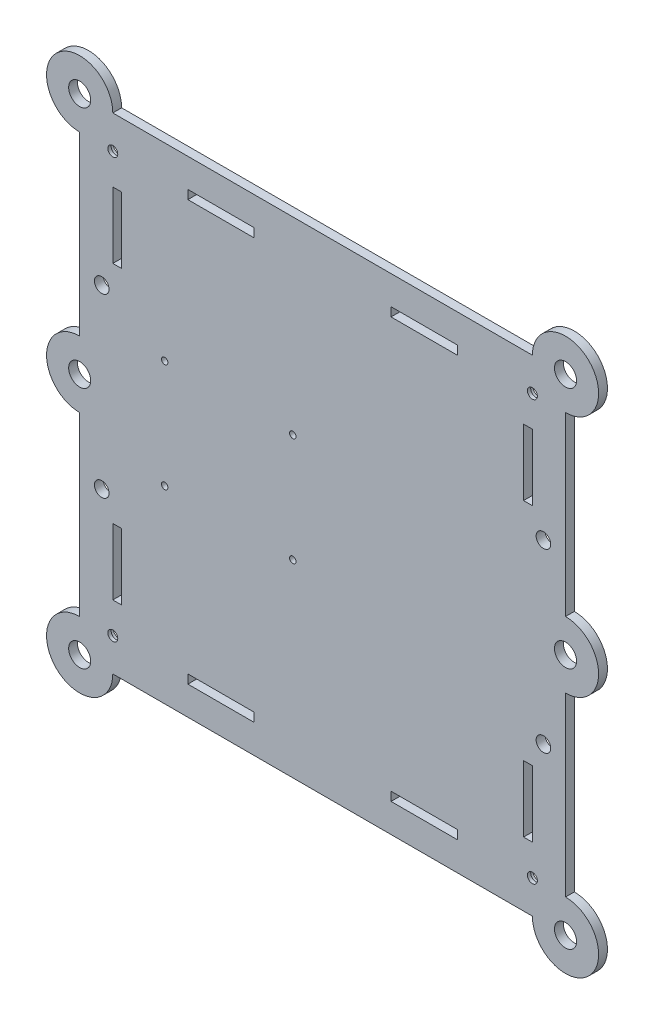
from build123d import *

# Parameters (mm, degrees)
FONDO_START                   = -54
SK_FONDO_R                    = 5
FONDO_DEPTH                   = 4
PASANTES_M4_SEPARADORES_START = -54
SK_PASANTES_M4_SEPARADORES_R  = 2.25
PASANTES_M4_SEPARADORES_DEPTH = 4
AVELLANADO_M4_START           = -54
SK_AVELLANADO_M4_R            = 4.2
AVELLANADO_M4_DEPTH           = 2.5
PASANTES_M2_5_RPI_START       = -54
SK_PASANTES_M2_5_RPI_R        = 1.45
PASANTES_M2_5_RPI_DEPTH       = 4
AVELLANADO_M2_5_START         = -54
SK_AVELLANADO_M2_5_R          = 2.5
AVELLANADO_M2_5_DEPTH         = 1.5
AGUJEROS_ANCLAJE_START        = -54
SK_AGUJEROS_ANCLAJE_R         = 3.3
AGUJEROS_ANCLAJE_DEPTH        = 4
CROQUIS3_W                    = 30
CROQUIS3_H                    = 4
CROQUIS3_W_2                  = 4
CROQUIS3_H_2                  = 30
CORTAR_EXTRUIR1_DEPTH         = 177.821944339


with BuildPart() as part:
    # Sk_Fondo → Fondo (new body)
    with BuildSketch(Plane.XY.offset(FONDO_START)):
        with BuildLine():
            Line((-110, 15), (-110, 95))
            ThreePointArc((-110, 95), (-120.606601718, 120.606601718), (-95, 110))
            Line((-95, 110), (95, 110))
            ThreePointArc((95, 110), (120.606601718, 120.606601718), (110, 95))
            Line((110, 95), (110, 15))
            ThreePointArc((110, 15), (125, 0), (110, -15))
            Line((110, -15), (110, -95))
            ThreePointArc((110, -95), (120.606601718, -120.606601718), (95, -110))
            Line((95, -110), (-95, -110))
            ThreePointArc((-95, -110), (-120.606601718, -120.606601718), (-110, -95))
            Line((-110, -95), (-110, -15))
            ThreePointArc((-110, -15), (-125, 0), (-110, 15))
        make_face()
        with Locations((-110, 110)):
            Circle(SK_FONDO_R, mode=Mode.SUBTRACT)
        with Locations((110, 110)):
            Circle(SK_FONDO_R, mode=Mode.SUBTRACT)
        with Locations((110, 0)):
            Circle(SK_FONDO_R, mode=Mode.SUBTRACT)
        with Locations((110, -110)):
            Circle(SK_FONDO_R, mode=Mode.SUBTRACT)
        with Locations((-110, -110)):
            Circle(SK_FONDO_R, mode=Mode.SUBTRACT)
        with Locations((-110, 0)):
            Circle(SK_FONDO_R, mode=Mode.SUBTRACT)
    extrude(amount=FONDO_DEPTH)

    # Sk_Pasantes_M4_separadores → Pasantes_M4_separadores (cut)
    with BuildSketch(Plane.XY.offset(PASANTES_M4_SEPARADORES_START)):
        with Locations((-95, -95)):
            Circle(SK_PASANTES_M4_SEPARADORES_R)
        with Locations((-95, 95)):
            Circle(SK_PASANTES_M4_SEPARADORES_R)
        with Locations((95, -95)):
            Circle(SK_PASANTES_M4_SEPARADORES_R)
        with Locations((95, 95)):
            Circle(SK_PASANTES_M4_SEPARADORES_R)
    extrude(amount=PASANTES_M4_SEPARADORES_DEPTH, mode=Mode.SUBTRACT)

    # Sk_Avellanado_M4 → Avellanado_M4 (cut)
    with BuildSketch(Plane.XY.offset(AVELLANADO_M4_START)):
        with Locations((-95, -95)):
            Circle(SK_AVELLANADO_M4_R)
        with Locations((-95, 95)):
            Circle(SK_AVELLANADO_M4_R)
        with Locations((95, -95)):
            Circle(SK_AVELLANADO_M4_R)
        with Locations((95, 95)):
            Circle(SK_AVELLANADO_M4_R)
    extrude(amount=AVELLANADO_M4_DEPTH, mode=Mode.SUBTRACT)

    # Sk_Pasantes_M2-5_RPi → Pasantes_M2-5_RPi (cut)
    with BuildSketch(Plane.XY.offset(PASANTES_M2_5_RPI_START)):
        with Locations((-13.5, -24.5)):
            Circle(SK_PASANTES_M2_5_RPI_R)
        with Locations((-13.5, 24.5)):
            Circle(SK_PASANTES_M2_5_RPI_R)
        with Locations((-71.5, -24.5)):
            Circle(SK_PASANTES_M2_5_RPI_R)
        with Locations((-71.5, 24.5)):
            Circle(SK_PASANTES_M2_5_RPI_R)
    extrude(amount=PASANTES_M2_5_RPI_DEPTH, mode=Mode.SUBTRACT)

    # Sk_Avellanado_M2-5 → Avellanado_M2-5 (cut)
    with BuildSketch(Plane.XY.offset(AVELLANADO_M2_5_START)):
        with Locations((-13.5, -24.5)):
            Circle(SK_AVELLANADO_M2_5_R)
        with Locations((-13.5, 24.5)):
            Circle(SK_AVELLANADO_M2_5_R)
        with Locations((-71.5, -24.5)):
            Circle(SK_AVELLANADO_M2_5_R)
        with Locations((-71.5, 24.5)):
            Circle(SK_AVELLANADO_M2_5_R)
    extrude(amount=AVELLANADO_M2_5_DEPTH, mode=Mode.SUBTRACT)

    # Sk_Agujeros_anclaje → Agujeros_anclaje (cut)
    with BuildSketch(Plane.XY.offset(AGUJEROS_ANCLAJE_START)):
        with Locations((-100, -40)):
            Circle(SK_AGUJEROS_ANCLAJE_R)
        with Locations((-100, 40)):
            Circle(SK_AGUJEROS_ANCLAJE_R)
        with Locations((100, -40)):
            Circle(SK_AGUJEROS_ANCLAJE_R)
        with Locations((100, 40)):
            Circle(SK_AGUJEROS_ANCLAJE_R)
    extrude(amount=AGUJEROS_ANCLAJE_DEPTH, mode=Mode.SUBTRACT)

    # Croquis3 → Cortar-Extruir1 (cut, through all)
    with BuildSketch(Plane.XY.offset(-50)):
        with Locations((-46, -95)):
            Rectangle(CROQUIS3_W, CROQUIS3_H)
        with Locations((46, -95)):
            Rectangle(CROQUIS3_W, CROQUIS3_H)
        with Locations((46, 95)):
            Rectangle(CROQUIS3_W, CROQUIS3_H)
        with Locations((-46, 95)):
            Rectangle(CROQUIS3_W, CROQUIS3_H)
        with Locations((-93, -65.98)):
            Rectangle(CROQUIS3_W_2, CROQUIS3_H_2)
        with Locations((-93, 65.98)):
            Rectangle(CROQUIS3_W_2, CROQUIS3_H_2)
        with Locations((93, 65.98)):
            Rectangle(CROQUIS3_W_2, CROQUIS3_H_2)
        with Locations((93, -65.98)):
            Rectangle(CROQUIS3_W_2, CROQUIS3_H_2)
    extrude(amount=-CORTAR_EXTRUIR1_DEPTH, mode=Mode.SUBTRACT)


solid = part.part
